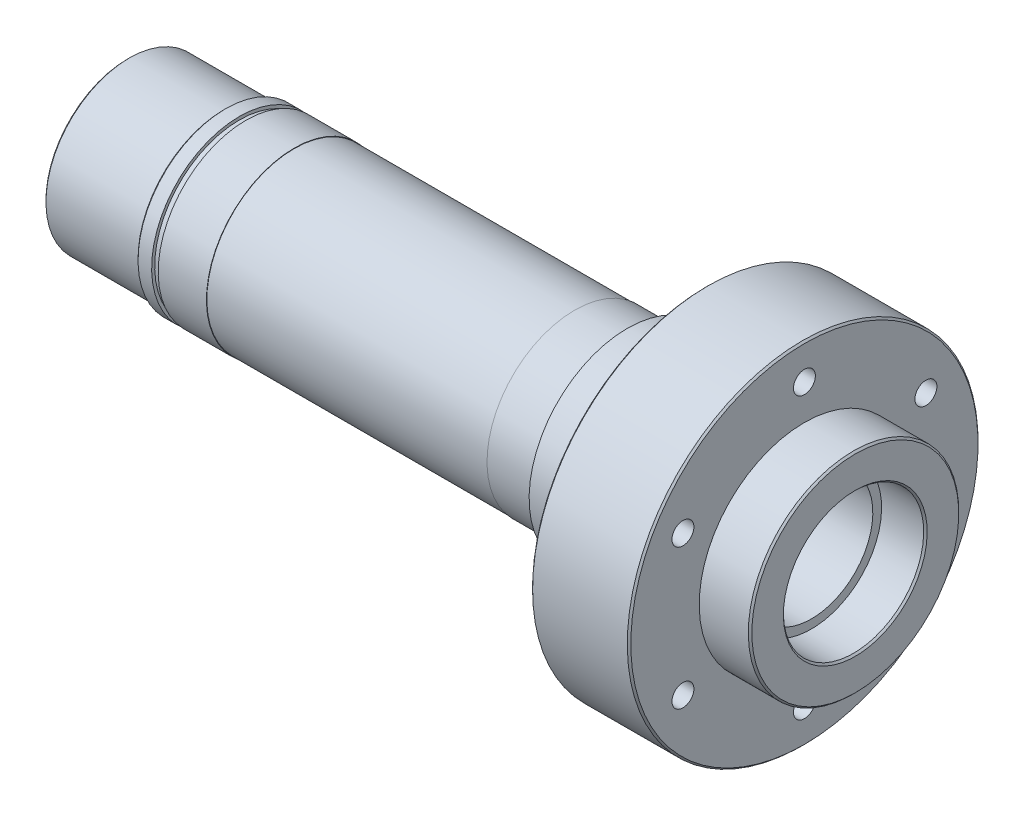
from build123d import *

# Parameters (mm, degrees)
SMUSSO1_SIZE                = 1
SMUSSO2_SIZE                = 1
SCHIZZO6_R                  = 6.25
TAGLIO_ESTRUSIONE1_DEPTH    = 56
RIPETIZIONECIRCOLARE1_COUNT = 6


with BuildPart() as part:
    # Schizzo1 → Rivoluzione1 (revolve)
    with BuildSketch(Plane.XY):
        Polygon((13.630317818, 50), (-16.369682182, 50), (-16.369682182, 49.75), (-176.369682182, 49.75), (-176.369682182, 50), (-203.869682182, 50), (-203.869682182, 48.25), (-207.619682182, 48.25), (-207.619682182, 50), (-216.369682182, 50), (-216.369682182, 47.5), (-271.369682182, 47.5), (-271.369682182, 40), (-246.369682182, 40), (-246.369682182, 35), (118.630317818, 35), (118.630317818, 40), (143.630317818, 40), (143.630317818, 60), (114.630317818, 60), (114.630317818, 100), (58.630317818, 100), (58.630317818, 60), (36.630317818, 60), (31.672388014, 56), (13.630317818, 56), align=None)
    revolve(axis=Axis((0, 0, 0), (-1, 0, 0)))

    # Smusso1
    smusso1_edges = [part.edges().sort_by_distance(p)[0] for p in [
        (58.630317818, -100, 0),
        (114.630317818, -100, 0),
        (143.630317818, -60, 0),
    ]]
    chamfer(smusso1_edges, length=SMUSSO1_SIZE)

    # Smusso2
    smusso2_edges = [part.edges().sort_by_distance(p)[0] for p in [
        (143.630317818, -40, 0),
        (-271.369682182, -40, 0),
        (-271.369682182, -47.5, 0),
        (-216.369682182, -50, 0),
    ]]
    chamfer(smusso2_edges, length=SMUSSO2_SIZE)

    # Schizzo6 → Taglio-Estrusione1 (cut)
    with BuildSketch(Plane(origin=(114.630317818, 0, 0), x_dir=(0, 0, -1), z_dir=(1, 0, 0))):
        with Locations(Location((0, -80, 0), (0, 0, 90))):
            Circle(SCHIZZO6_R)
    taglio_estrusione1 = extrude(amount=-TAGLIO_ESTRUSIONE1_DEPTH, mode=Mode.SUBTRACT)

    # RipetizioneCircolare1: Taglio-Estrusione1 ×6 about axis
    ripetizionecircolare1_axis = Axis((0, 0, 0), (1, 0, 0))
    for i in range(1, RIPETIZIONECIRCOLARE1_COUNT):
        add(taglio_estrusione1.rotate(ripetizionecircolare1_axis, i * 360 / RIPETIZIONECIRCOLARE1_COUNT), mode=Mode.SUBTRACT)


solid = part.part
